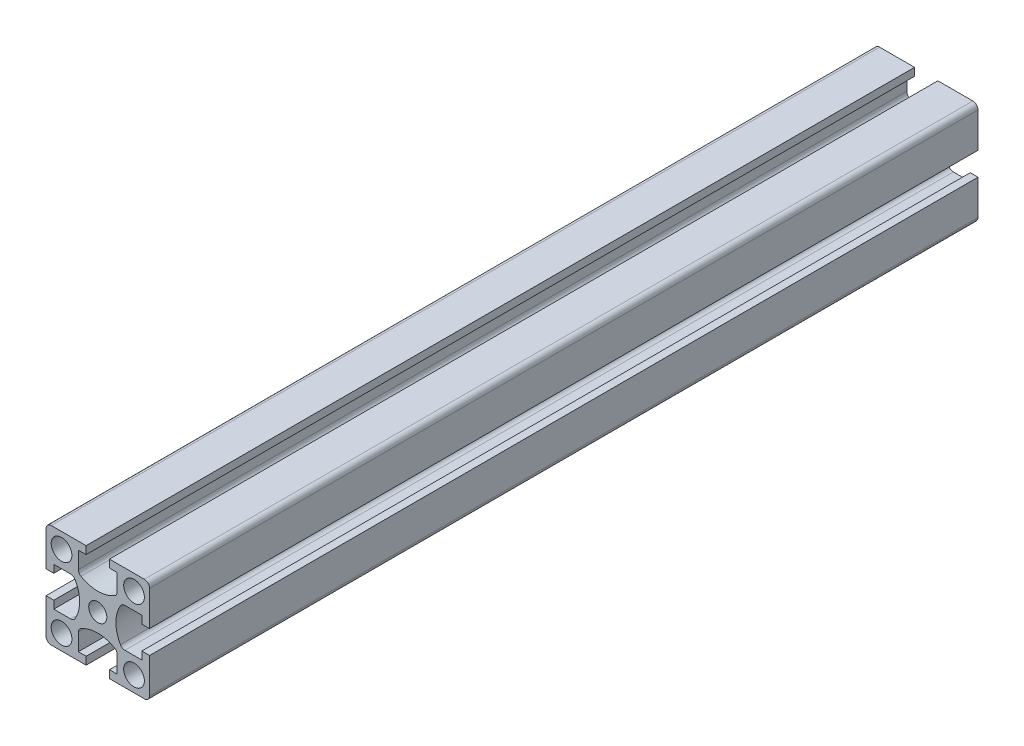
from build123d import *

# Parameters (mm, degrees)
SKETCH1_R           = 2.5
SKETCH1_R_2         = 2.1875
BOSS_EXTRUDE1_DEPTH = 200


with BuildPart() as part:
    # Sketch1 → Boss-Extrude1 (new body)
    with BuildSketch(Plane.XY):
        with BuildLine():
            Line((-12.5, 11.25), (-12.5, 2.8125))
            Line((-12.5, 2.8125), (-10.625, 2.8125))
            Line((-10.625, 2.8125), (-10.625, 4.6875))
            Line((-10.625, 4.6875), (-6.546075349, 4.6875))
            ThreePointArc((-6.546075349, 4.6875), (-5.921075349, 4.520031755), (-5.463543594, 4.0625))
            ThreePointArc((-5.463543594, 4.0625), (-4.375, 0), (-5.463543594, -4.0625))
            ThreePointArc((-5.463543594, -4.0625), (-5.921075349, -4.520031755), (-6.546075349, -4.6875))
            Line((-6.546075349, -4.6875), (-10.625, -4.6875))
            Line((-10.625, -4.6875), (-10.625, -2.8125))
            Line((-10.625, -2.8125), (-12.5, -2.8125))
            Line((-12.5, -2.8125), (-12.5, -11.25))
            ThreePointArc((-12.5, -11.25), (-12.133883476, -12.133883476), (-11.25, -12.5))
            Line((-11.25, -12.5), (-2.8125, -12.5))
            Line((-2.8125, -12.5), (-2.8125, -10.625))
            Line((-2.8125, -10.625), (-4.6875, -10.625))
            Line((-4.6875, -10.625), (-4.6875, -6.546075349))
            ThreePointArc((-4.6875, -6.546075349), (-4.520031755, -5.921075349), (-4.0625, -5.463543594))
            ThreePointArc((-4.0625, -5.463543594), (0, -4.375), (4.0625, -5.463543594))
            ThreePointArc((4.0625, -5.463543594), (4.520031755, -5.921075349), (4.6875, -6.546075349))
            Line((4.6875, -6.546075349), (4.6875, -10.625))
            Line((4.6875, -10.625), (2.8125, -10.625))
            Line((2.8125, -10.625), (2.8125, -12.5))
            Line((2.8125, -12.5), (11.25, -12.5))
            ThreePointArc((11.25, -12.5), (12.133883476, -12.133883476), (12.5, -11.25))
            Line((12.5, -11.25), (12.5, -2.8125))
            Line((12.5, -2.8125), (10.625, -2.8125))
            Line((10.625, -2.8125), (10.625, -4.6875))
            Line((10.625, -4.6875), (6.546075349, -4.6875))
            ThreePointArc((6.546075349, -4.6875), (5.921075349, -4.520031755), (5.463543594, -4.0625))
            ThreePointArc((5.463543594, -4.0625), (4.375, 0), (5.463543594, 4.0625))
            ThreePointArc((5.463543594, 4.0625), (5.921075349, 4.520031755), (6.546075349, 4.6875))
            Line((6.546075349, 4.6875), (10.625, 4.6875))
            Line((10.625, 4.6875), (10.625, 2.8125))
            Line((10.625, 2.8125), (12.5, 2.8125))
            Line((12.5, 2.8125), (12.5, 11.25))
            ThreePointArc((12.5, 11.25), (12.133883476, 12.133883476), (11.25, 12.5))
            Line((11.25, 12.5), (2.8125, 12.5))
            Line((2.8125, 12.5), (2.8125, 10.625))
            Line((2.8125, 10.625), (4.6875, 10.625))
            Line((4.6875, 10.625), (4.6875, 6.546075349))
            ThreePointArc((4.6875, 6.546075349), (4.520031755, 5.921075349), (4.0625, 5.463543594))
            ThreePointArc((4.0625, 5.463543594), (0, 4.375), (-4.0625, 5.463543594))
            ThreePointArc((-4.0625, 5.463543594), (-4.520031755, 5.921075349), (-4.6875, 6.546075349))
            Line((-4.6875, 6.546075349), (-4.6875, 10.625))
            Line((-4.6875, 10.625), (-2.8125, 10.625))
            Line((-2.8125, 10.625), (-2.8125, 12.5))
            Line((-2.8125, 12.5), (-11.25, 12.5))
            ThreePointArc((-11.25, 12.5), (-12.133883476, 12.133883476), (-12.5, 11.25))
        make_face()
        with Locations((-8.75, -8.75)):
            Circle(SKETCH1_R, mode=Mode.SUBTRACT)
        with Locations((8.75, -8.75)):
            Circle(SKETCH1_R, mode=Mode.SUBTRACT)
        with Locations((8.75, 8.75)):
            Circle(SKETCH1_R, mode=Mode.SUBTRACT)
        Circle(SKETCH1_R_2, mode=Mode.SUBTRACT)
        with Locations((-8.75, 8.75)):
            Circle(SKETCH1_R, mode=Mode.SUBTRACT)
    extrude(amount=BOSS_EXTRUDE1_DEPTH)


solid = part.part
